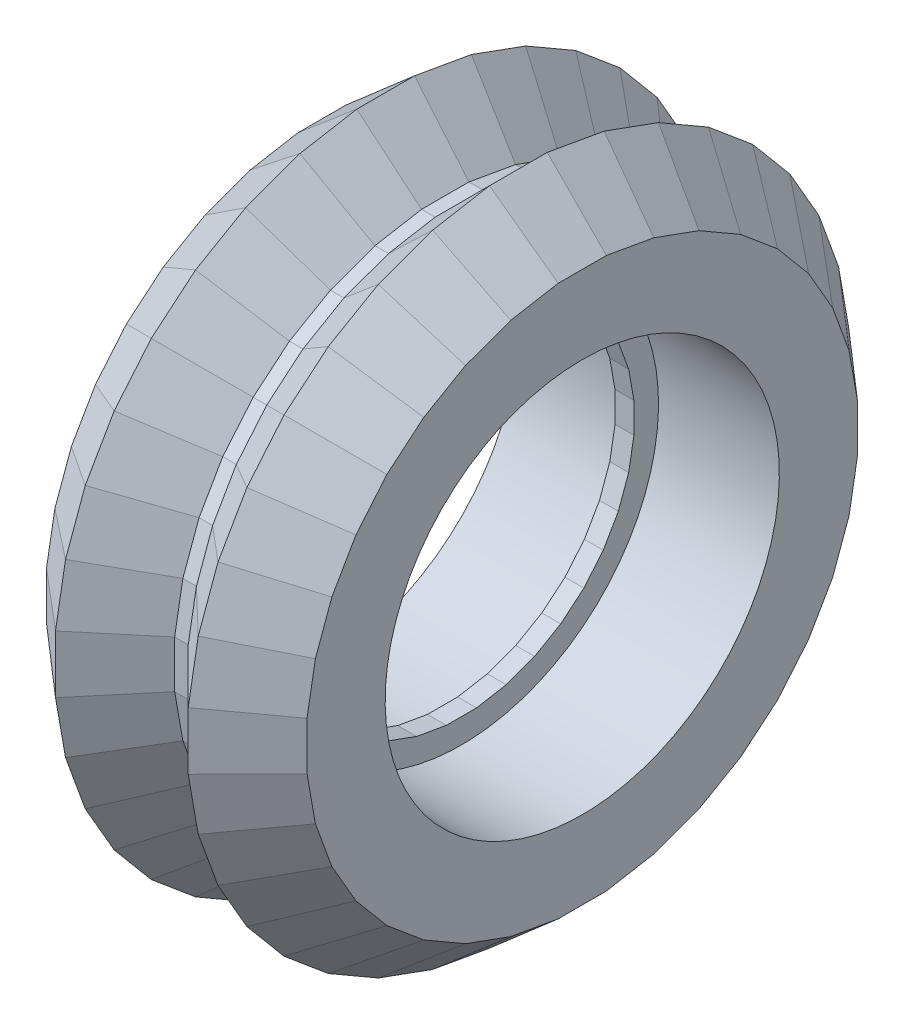
from build123d import *

# Parameters (mm, degrees)
SKETCH3_R          = 8
CUT_EXTRUDE1_DEPTH = 5
CUT_EXTRUDE2_START = 5
SKETCH4_R          = 8
CUT_EXTRUDE2_DEPTH = 5


with BuildPart() as part:
    # Sweep3: sweep along a path in Sketch2
    with BuildLine(Plane(origin=(0, 0, 0), x_dir=(0, 0, -1), z_dir=(1, 0, 0))) as sweep3_path:
        Line((3.117692302, -11.635386072), (5.090791138, -10.917236827))
        Line((5.090791138, -10.917236827), (6.909208862, -9.867372864))
        Line((6.909208862, -9.867372864), (8.517693771, -8.517693771))
        Line((8.517693771, -8.517693771), (9.867372864, -6.909208862))
        Line((9.867372864, -6.909208862), (10.917236827, -5.090791138))
        Line((10.917236827, -5.090791138), (11.635386072, -3.117692302))
        Line((11.635386072, -3.117692302), (12, -1.049863962))
        Line((12, -1.049863962), (12, 1.049863962))
        Line((12, 1.049863962), (11.635386072, 3.117692302))
        Line((11.635386072, 3.117692302), (10.917236827, 5.090791138))
        Line((10.917236827, 5.090791138), (9.867372864, 6.909208862))
        Line((9.867372864, 6.909208862), (8.517693771, 8.517693771))
        Line((8.517693771, 8.517693771), (6.909208862, 9.867372864))
        Line((6.909208862, 9.867372864), (5.090791138, 10.917236827))
        Line((5.090791138, 10.917236827), (3.117692302, 11.635386072))
        Line((3.117692302, 11.635386072), (1.049863962, 12))
        Line((1.049863962, 12), (-1.049863962, 12))
        Line((-1.049863962, 12), (-3.117692302, 11.635386072))
        Line((-3.117692302, 11.635386072), (-5.090791138, 10.917236827))
        Line((-5.090791138, 10.917236827), (-6.909208862, 9.867372864))
        Line((-6.909208862, 9.867372864), (-8.517693771, 8.517693771))
        Line((-8.517693771, 8.517693771), (-9.867372864, 6.909208862))
        Line((-9.867372864, 6.909208862), (-10.917236827, 5.090791138))
        Line((-10.917236827, 5.090791138), (-11.635386072, 3.117692302))
        Line((-11.635386072, 3.117692302), (-12, 1.049863962))
        Line((-12, 1.049863962), (-12, -1.049863962))
        Line((-12, -1.049863962), (-11.635386072, -3.117692302))
        Line((-11.635386072, -3.117692302), (-10.917236827, -5.090791138))
        Line((-10.917236827, -5.090791138), (-9.867372864, -6.909208862))
        Line((-9.867372864, -6.909208862), (-8.517693771, -8.517693771))
        Line((-8.517693771, -8.517693771), (-6.909208862, -9.867372864))
        Line((-6.909208862, -9.867372864), (-5.090791138, -10.917236827))
        Line((-5.090791138, -10.917236827), (-3.117692302, -11.635386072))
        Line((-3.117692302, -11.635386072), (-1.049863962, -12))
        Line((-1.049863962, -12), (1.049863962, -12))
        Line((1.049863962, -12), (3.117692302, -11.635386072))
    # Sketch1 → Sweep3 (sweep)
    with BuildSketch(Plane.XY):
        Polygon((-0.275, 10.981694808), (0.275, 10.981694808), (2.693305192, 13.4), (5.28627646, 11.17), (5.28627646, 7.782971269), (5.003305192, 7.5), (0.383305192, 7.5), (0.383305192, 7), (-0.383305192, 7), (-0.383305192, 7.5), (-5.003305192, 7.5), (-5.28627646, 7.782971269), (-5.28627646, 11.17), (-2.693305192, 13.4), align=None)
    sweep(path=sweep3_path.line, transition=Transition.RIGHT)

    # Sketch3 → Cut-Extrude1 (cut)
    with BuildSketch(Plane.ZY.offset(0.383305192)):
        with Locations(Location((0, 0, 0), (0, 0, 270))):
            Circle(SKETCH3_R)
    extrude(amount=CUT_EXTRUDE1_DEPTH, mode=Mode.SUBTRACT)

    # Sketch4 → Cut-Extrude2 (cut)
    with BuildSketch(Plane(origin=(0.383305192, 0, 0), x_dir=(0, 0, -1), z_dir=(1, 0, 0)).offset(CUT_EXTRUDE2_START)):
        with Locations(Location((0, 0, 0), (0, 0, 270))):
            Circle(SKETCH4_R)
    extrude(amount=-CUT_EXTRUDE2_DEPTH, mode=Mode.SUBTRACT)


solid = part.part
